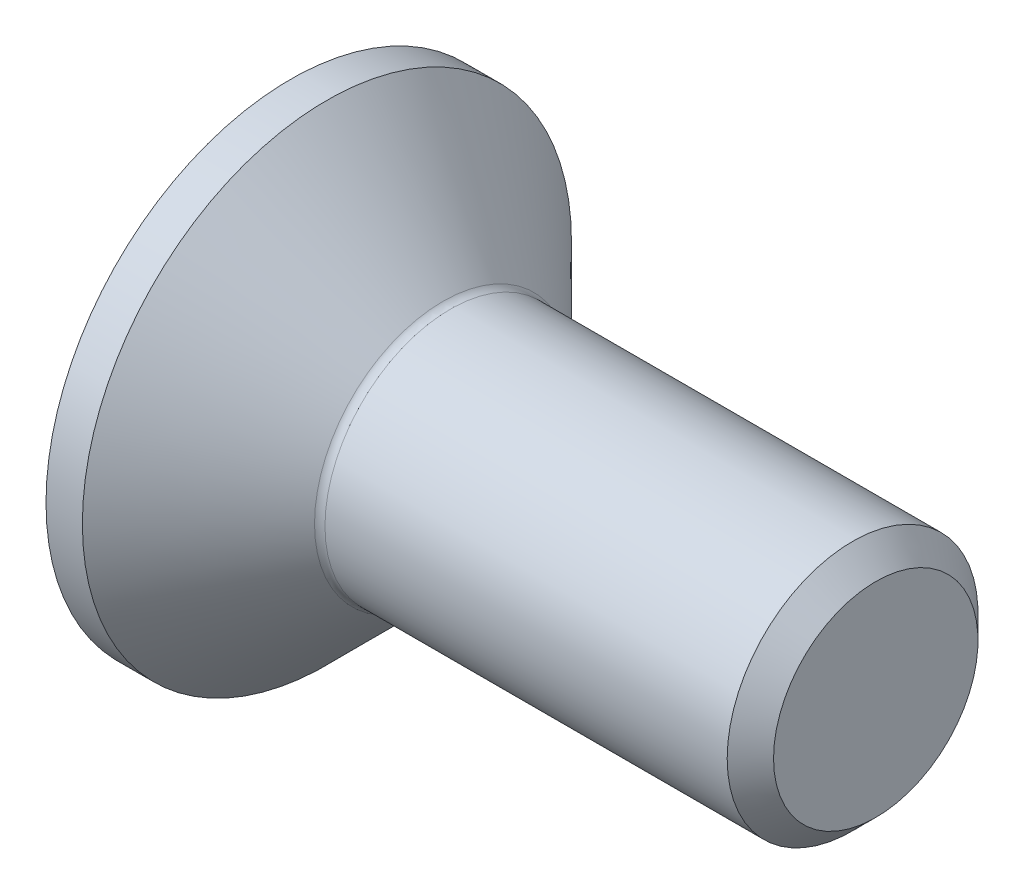
from build123d import *

# Parameters (mm, degrees)
FILLET1_R   = 0.25
HEX_2_DEPTH = 2.2


with BuildPart() as part:
    # BodySke → BaseBody (revolve)
    with BuildSketch(Plane.XY, mode=Mode.PRIVATE) as basebody_sk:
        Polygon((0, 0), (0, 5.85), (0.87, 5.85), (3.72, 3), (13.4455, 3), (14, 2.4455), (14, 0), align=None)
    revolve(basebody_sk.sketch.rotate(Axis((0, 0, 0), (1, 0, 0)), 90), axis=Axis((0, 0, 0), (1, 0, 0)))

    # Fillet1
    fillet1_edges = [part.edges().sort_by_distance(p)[0] for p in [
        (3.72, 0, -3),
    ]]
    fillet(fillet1_edges, radius=FILLET1_R)

    # Sketch2 → PreBroach (revolve, cut)
    with BuildSketch(Plane.XY, mode=Mode.PRIVATE) as prebroach_sk:
        Polygon((0, 2), (2.2, 2), (3.354700538, 0), (0, 0), align=None)
    revolve(prebroach_sk.sketch.rotate(Axis((0, 0, 0), (1, 0, 0)), 90), axis=Axis((0, 0, 0), (1, 0, 0)), mode=Mode.SUBTRACT)

    # Sketch3 → Hex 2 (cut)
    with BuildSketch(Plane.ZY):
        Polygon((-2, -1.154700538), (-2, 1.154700538), (0, 2.309401077), (2, 1.154700538), (2, -1.154700538), (0, -2.309401077), align=None)
    extrude(amount=-HEX_2_DEPTH, mode=Mode.SUBTRACT)


solid = part.part
